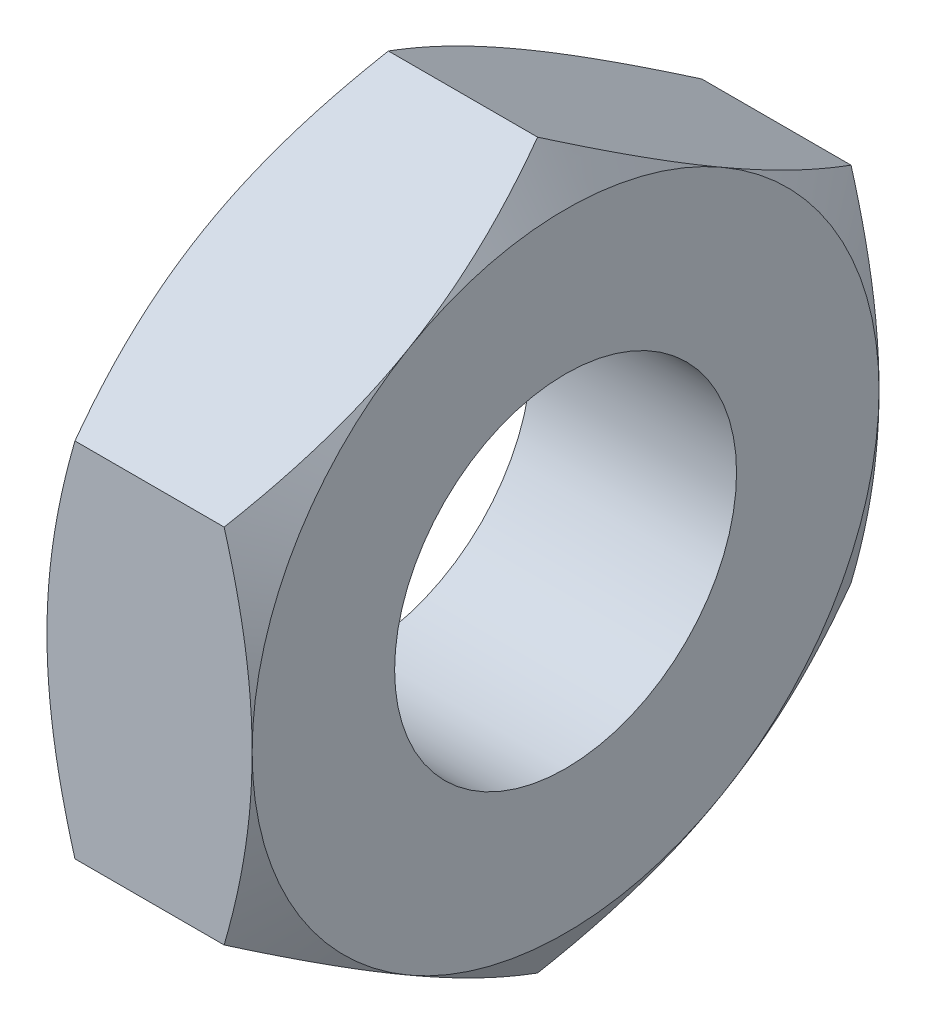
from build123d import *

# Parameters (mm, degrees)
BOSS_EXTRUDE1_DEPTH = 2.4
SKETCH5_W           = 0.6
SKETCH5_H           = 3.175426481
SKETCH7_R           = 1.5
CUT_EXTRUDE1_DEPTH  = 5.570102114


with BuildPart() as part:
    # Sketch1 → Boss-Extrude1 (new body)
    with BuildSketch(Plane(origin=(0, 0, 0), x_dir=(0, 0, -1), z_dir=(1, 0, 0))):
        Polygon((0, 3.175426481), (-2.75, 1.58771324), (-2.75, -1.58771324), (0, -3.175426481), (2.75, -1.58771324), (2.75, 1.58771324), align=None)
    extrude(amount=-BOSS_EXTRUDE1_DEPTH)

    # Sketch2 → Cut-Revolve1 (revolve, cut)
    with BuildSketch(Plane.XY):
        Polygon((-2.4, 2.75), (-2.154379907, 3.175426481), (-2.4, 3.175426481), align=None)
    revolve(axis=Axis((-2.23854625, 0, 0), (1, 0, 0)), mode=Mode.SUBTRACT)

    # Sketch5 → Cut-Revolve2 (revolve, cut)
    with BuildSketch(Plane.XY):
        with Locations((-2.1, 1.587713241)):
            Rectangle(SKETCH5_W, SKETCH5_H)
    revolve(axis=Axis((0, 0, 0), (-1, 0, 0)), mode=Mode.SUBTRACT)

    # Sketch6 → Cut-Revolve3 (revolve, cut)
    with BuildSketch(Plane.XY):
        Polygon((-1.8, 2.75), (-1.554379907, 3.175426481), (-1.8, 3.175426481), align=None)
        Polygon((0, 2.75), (-0.245620093, 3.175426481), (0, 3.175426481), align=None)
    revolve(axis=Axis((-1.686959968, 0, 0), (1, 0, 0)), mode=Mode.SUBTRACT)

    # Sketch7 → Cut-Extrude1 (cut, through all)
    with BuildSketch(Plane(origin=(0, 0, 0), x_dir=(0, 0, -1), z_dir=(1, 0, 0))):
        Circle(SKETCH7_R)
    extrude(amount=-CUT_EXTRUDE1_DEPTH, mode=Mode.SUBTRACT)


solid = part.part
